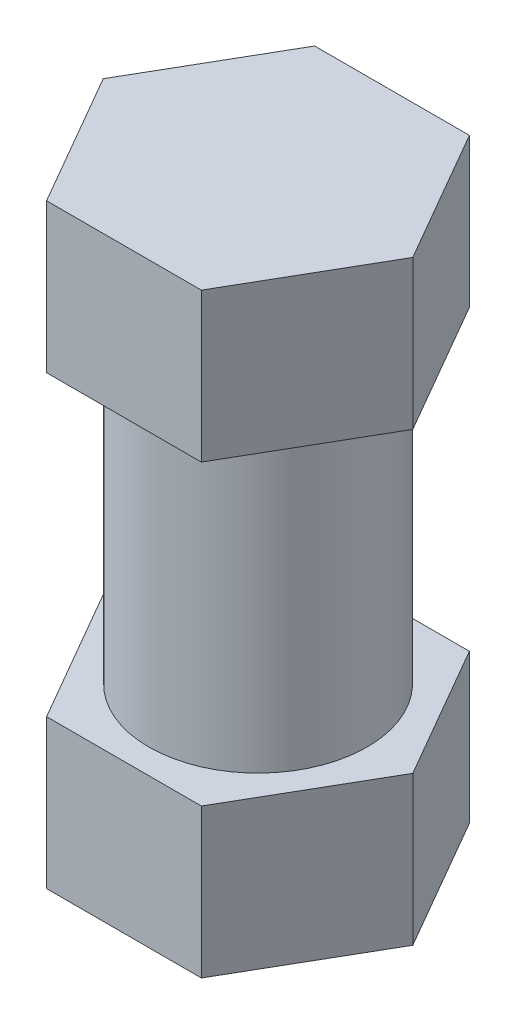
from build123d import *

# Parameters (mm, degrees)
SKETCH1_R           = 2.2
BOSS_EXTRUDE1_DEPTH = 3
BOSS_EXTRUDE2_DEPTH = 3


with BuildPart() as part:
    # Sketch1 → Boss-Extrude1 (new body)
    with BuildSketch(Plane(origin=(0, 0, 0), x_dir=(1, 0, 0), z_dir=(0, 1, 0))):
        with Locations(Location((0, 0, 0), (0, 0, 270))):
            Circle(SKETCH1_R)
    boss_extrude1 = extrude(amount=BOSS_EXTRUDE1_DEPTH)

    # Sketch2 → Boss-Extrude2 (add)
    with BuildSketch(Plane(origin=(0, 3, 0), x_dir=(1, 0, 0), z_dir=(0, 1, 0))):
        Polygon((-1.558845727, 2.7), (-3.117691454, 0), (-1.558845727, -2.7), (1.558845727, -2.7), (3.117691454, 0), (1.558845727, 2.7), align=None)
    boss_extrude2 = extrude(amount=BOSS_EXTRUDE2_DEPTH)

    # Mirror1: Boss-Extrude1, Boss-Extrude2 across plane
    add(boss_extrude1.mirror(Plane.ZX))
    add(boss_extrude2.mirror(Plane.ZX))


solid = part.part
